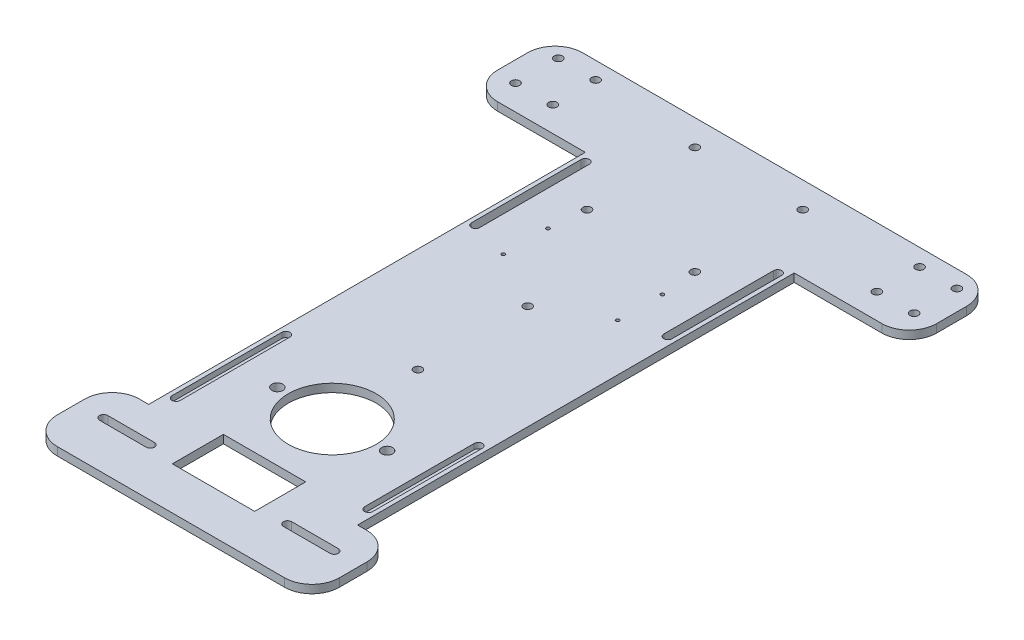
from build123d import *

# Parameters (mm, degrees)
SKETCH1_W           = 160
SKETCH1_H           = 220
BOSS_EXTRUDE1_DEPTH = 3
SKETCH3_R           = 1.5
CUT_EXTRUDE1_DEPTH  = 3
SKETCH4_R           = 1.5
CUT_EXTRUDE2_DEPTH  = 3
SKETCH5_R           = 1.5
CUT_EXTRUDE3_DEPTH  = 3
SKETCH6_R           = 0.635
CUT_EXTRUDE4_DEPTH  = 3
SKETCH7_W           = 30
SKETCH7_H           = 18.607589123
CUT_EXTRUDE5_DEPTH  = 3
SKETCH8_W           = 22
SKETCH8_H           = 179.95337022
CUT_EXTRUDE6_DEPTH  = 3
SKETCH10_R          = 2
CUT_EXTRUDE7_DEPTH  = 3
CUT_EXTRUDE8_DEPTH  = 3
FILLET1_R           = 10
FILLET2_R           = 10
FILLET3_R           = 10
CUT_EXTRUDE9_DEPTH  = 10
SKETCH13_R          = 16
CUT_EXTRUDE10_DEPTH = 10
CUT_EXTRUDE11_DEPTH = 2


with BuildPart() as part:
    # Sketch1 → Boss-Extrude1 (new body)
    with BuildSketch(Plane(origin=(0, 0, 0), x_dir=(1, 0, 0), z_dir=(0, 1, 0))):
        Rectangle(SKETCH1_W, SKETCH1_H)
    extrude(amount=BOSS_EXTRUDE1_DEPTH)

    # Sketch3 → Cut-Extrude1 (cut)
    with BuildSketch(Plane(origin=(0, 3, 0), x_dir=(1, 0, 0), z_dir=(0, 1, 0))):
        with Locations(Location((-59.03, 88.2, 0), (0, 0, 270))):
            Circle(SKETCH3_R)
        with Locations(Location((-72.63, 88.2, 0), (0, 0, 270))):
            Circle(SKETCH3_R)
        with Locations(Location((-59.03, 103.8, 0), (0, 0, 270))):
            Circle(SKETCH3_R)
        with Locations(Location((-72.63, 103.8, 0), (0, 0, 270))):
            Circle(SKETCH3_R)
        with Locations(Location((72.63, 103.8, 0), (0, 0, 90))):
            Circle(SKETCH3_R)
        with Locations(Location((59.03, 103.8, 0), (0, 0, 90))):
            Circle(SKETCH3_R)
        with Locations(Location((72.63, 88.2, 0), (0, 0, 90))):
            Circle(SKETCH3_R)
        with Locations(Location((59.03, 88.2, 0), (0, 0, 90))):
            Circle(SKETCH3_R)
    extrude(amount=-CUT_EXTRUDE1_DEPTH, mode=Mode.SUBTRACT)

    # Sketch4 → Cut-Extrude2 (cut)
    with BuildSketch(Plane(origin=(0, 3, 0), x_dir=(1, 0, 0), z_dir=(0, 1, 0))):
        with Locations(Location((-19.65, 100.584248084, 0), (0, 0, 270))):
            Circle(SKETCH4_R)
        with Locations(Location((19.65, 100.584248084, 0), (0, 0, 90))):
            Circle(SKETCH4_R)
        with Locations(Location((19.65, 61.284248084, 0), (0, 0, 270))):
            Circle(SKETCH4_R)
        with Locations(Location((-19.65, 61.284248084, 0), (0, 0, 90))):
            Circle(SKETCH4_R)
    extrude(amount=-CUT_EXTRUDE2_DEPTH, mode=Mode.SUBTRACT)

    # Sketch5 → Cut-Extrude3 (cut)
    with BuildSketch(Plane(origin=(0, 3, 0), x_dir=(1, 0, 0), z_dir=(0, 1, 0))):
        with Locations(Location((0, 20, 0), (0, 0, 270))):
            Circle(SKETCH5_R)
        with Locations(Location((0, -20, 0), (0, 0, 270))):
            Circle(SKETCH5_R)
    extrude(amount=-CUT_EXTRUDE3_DEPTH, mode=Mode.SUBTRACT)

    # Sketch6 → Cut-Extrude4 (cut)
    with BuildSketch(Plane(origin=(0, 3, 0), x_dir=(1, 0, 0), z_dir=(0, 1, 0))):
        with Locations(Location((-20.83, 48.244137144, 0), (0, 0, 270))):
            Circle(SKETCH6_R)
        with Locations(Location((20.83, 48.244137144, 0), (0, 0, 90))):
            Circle(SKETCH6_R)
        with Locations(Location((20.83, 31.984137144, 0), (0, 0, 270))):
            Circle(SKETCH6_R)
        with Locations(Location((-20.83, 31.984137144, 0), (0, 0, 90))):
            Circle(SKETCH6_R)
    extrude(amount=-CUT_EXTRUDE4_DEPTH, mode=Mode.SUBTRACT)

    # Sketch7 → Cut-Extrude5 (cut)
    with BuildSketch(Plane(origin=(0, 3, 0), x_dir=(1, 0, 0), z_dir=(0, 1, 0))):
        with BuildLine():
            Line((-42, -91), (-25, -91))
            ThreePointArc((-25, -91), (-23.5, -92.5), (-25, -94))
            Line((-25, -94), (-42, -94))
            ThreePointArc((-42, -94), (-43.5, -92.5), (-42, -91))
        make_face()
        with Locations((0, -85.183731289)):
            Rectangle(SKETCH7_W, SKETCH7_H)
        with BuildLine():
            Line((42, -91), (25, -91))
            ThreePointArc((25, -91), (23.5, -92.5), (25, -94))
            Line((25, -94), (42, -94))
            ThreePointArc((42, -94), (43.5, -92.5), (42, -91))
        make_face()
    extrude(amount=-CUT_EXTRUDE5_DEPTH, mode=Mode.SUBTRACT)

    # Sketch8 → Cut-Extrude6 (cut)
    with BuildSketch(Plane(origin=(0, 3, 0), x_dir=(1, 0, 0), z_dir=(0, 1, 0))):
        with Locations((69, -20.02331489)):
            Rectangle(SKETCH8_W, SKETCH8_H)
        with Locations((-69, -20.02331489)):
            Rectangle(SKETCH8_W, SKETCH8_H)
    extrude(amount=-CUT_EXTRUDE6_DEPTH, mode=Mode.SUBTRACT)

    # Sketch10 → Cut-Extrude7 (cut)
    with BuildSketch(Plane(origin=(0, 3, 0), x_dir=(1, 0, 0), z_dir=(0, 1, 0))):
        with Locations(Location((-20, -51.206202612, 0), (0, 0, 270))):
            Circle(SKETCH10_R)
        with Locations(Location((20, -51.206202612, 0), (0, 0, 270))):
            Circle(SKETCH10_R)
    extrude(amount=-CUT_EXTRUDE7_DEPTH, mode=Mode.SUBTRACT)

    # Sketch11 → Cut-Extrude8 (cut)
    with BuildSketch(Plane(origin=(0, 3, 0), x_dir=(1, 0, 0), z_dir=(0, 1, 0))):
        Polygon((-80, 79.063576574), (-38.06764798, 79.063576574), (-38.06764798, -80.039670112), (-51.407592999, -80.039670112), (-51.407592999, -110), (-58, -110), (-58, 69.95337022), (-80, 69.95337022), align=None)
        Polygon((80, 69.95337022), (80, 79.063576574), (38.06764798, 79.063576574), (38.06764798, -80.039670112), (51.407592999, -80.039670112), (51.407592999, -110), (58, -110), (58, 69.95337022), align=None)
    extrude(amount=-CUT_EXTRUDE8_DEPTH, mode=Mode.SUBTRACT)

    # Fillet1
    fillet1_edges = [part.edges().sort_by_distance(p)[0] for p in [
        (-51.407592999, 1.5, 110),
    ]]
    fillet(fillet1_edges, radius=FILLET1_R)

    # Fillet2
    fillet2_edges = [part.edges().sort_by_distance(p)[0] for p in [
        (-80, 1.5, -79.063576574),
        (-51.407592999, 1.5, 80.039670112),
        (80, 1.5, -79.063576574),
        (-80, 1.5, -110),
        (80, 1.5, -110),
    ]]
    fillet(fillet2_edges, radius=FILLET2_R)

    # Fillet3
    fillet3_edges = [part.edges().sort_by_distance(p)[0] for p in [
        (51.407592999, 1.5, 110),
        (51.407592999, 1.5, 80.039670112),
    ]]
    fillet(fillet3_edges, radius=FILLET3_R)

    # Sketch12 → Cut-Extrude9 (cut)
    with BuildSketch(Plane(origin=(0, 3, 0), x_dir=(1, 0, 0), z_dir=(0, 1, 0))):
        with BuildLine():
            Line((-36.56764798, 36.063576574), (-36.56764798, 76.063576574))
            ThreePointArc((-36.56764798, 76.063576574), (-35.06764798, 77.563576574), (-33.56764798, 76.063576574))
            Line((-33.56764798, 76.063576574), (-33.56764798, 36.063576574))
            ThreePointArc((-33.56764798, 36.063576574), (-35.06764798, 34.563576574), (-36.56764798, 36.063576574))
        make_face()
        with BuildLine():
            Line((36.56764798, 36.063576574), (36.56764798, 76.063576574))
            ThreePointArc((36.56764798, 76.063576574), (35.06764798, 77.563576574), (33.56764798, 76.063576574))
            Line((33.56764798, 76.063576574), (33.56764798, 36.063576574))
            ThreePointArc((33.56764798, 36.063576574), (35.06764798, 34.563576574), (36.56764798, 36.063576574))
        make_face()
    extrude(amount=-CUT_EXTRUDE9_DEPTH, mode=Mode.SUBTRACT)

    # Sketch13 → Cut-Extrude10 (cut)
    with BuildSketch(Plane(origin=(0, 3, 0), x_dir=(1, 0, 0), z_dir=(0, 1, 0))):
        with Locations(Location((0, -51.206202612, 0), (0, 0, 270))):
            Circle(SKETCH13_R)
    extrude(amount=-CUT_EXTRUDE10_DEPTH, mode=Mode.SUBTRACT)

    # Sketch14 → Cut-Extrude11 (cut)
    with BuildSketch(Plane(origin=(0, 3, 0), x_dir=(1, 0, 0), z_dir=(0, 1, 0))):
        with BuildLine():
            Line((-36.56764798, -73.039670112), (-36.56764798, -33.039670112))
            ThreePointArc((-36.56764798, -33.039670112), (-35.06764798, -31.539670112), (-33.56764798, -33.039670112))
            Line((-33.56764798, -33.039670112), (-33.56764798, -73.039670112))
            ThreePointArc((-33.56764798, -73.039670112), (-35.06764798, -74.539670112), (-36.56764798, -73.039670112))
        make_face()
        with BuildLine():
            Line((36.56764798, -73.039670112), (36.56764798, -33.039670112))
            ThreePointArc((36.56764798, -33.039670112), (35.06764798, -31.539670112), (33.56764798, -33.039670112))
            Line((33.56764798, -33.039670112), (33.56764798, -73.039670112))
            ThreePointArc((33.56764798, -73.039670112), (35.06764798, -74.539670112), (36.56764798, -73.039670112))
        make_face()
    extrude(amount=-CUT_EXTRUDE11_DEPTH, mode=Mode.SUBTRACT)


solid = part.part
